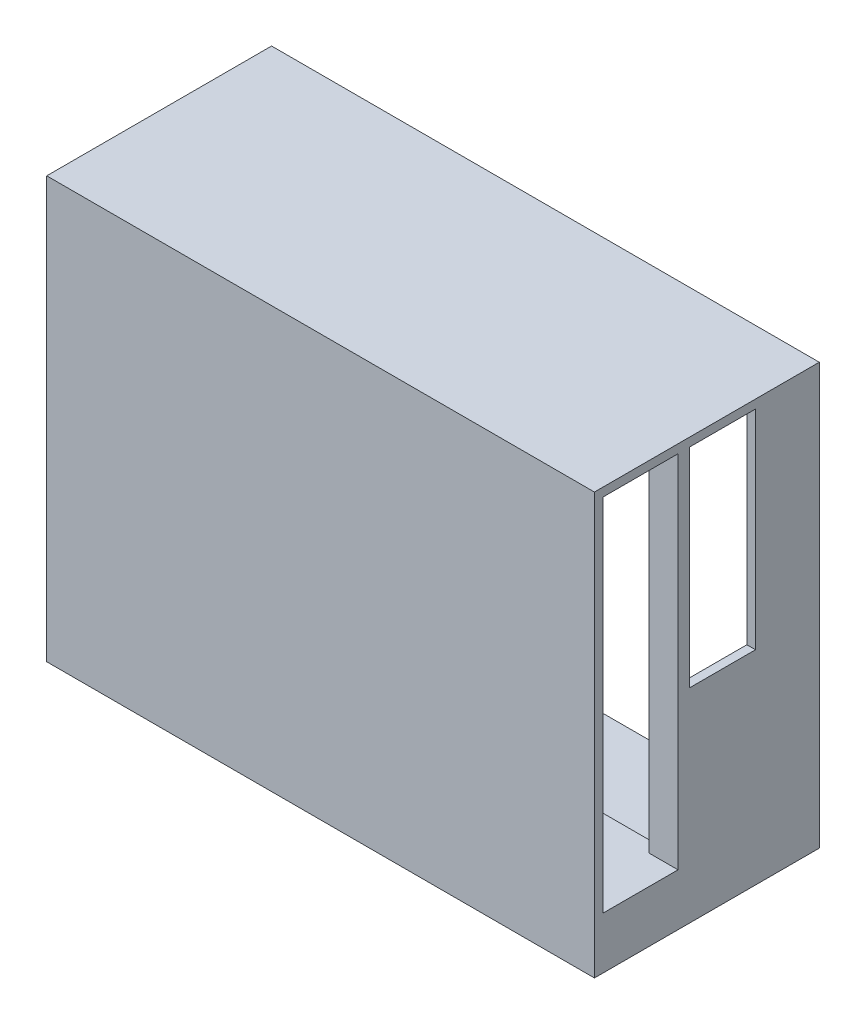
from build123d import *

# Parameters (mm, degrees)
ESQUISSE3_W             = 190
ESQUISSE3_H             = 146
BOSS_EXTRU_3_DEPTH      = 3
ESQUISSE4_W             = 190
ESQUISSE4_H             = 3
BOSS_EXTRU_4_DEPTH      = 75
ESQUISSE5_W             = 190
ESQUISSE5_H             = 3
BOSS_EXTRU_5_DEPTH      = 75
ESQUISSE6_W             = 3
ESQUISSE6_H             = 140
BOSS_EXTRU_6_DEPTH      = 75
ESQUISSE7_W             = 3
ESQUISSE7_H             = 140
BOSS_EXTRU_7_DEPTH      = 75
ESQUISSE8_W             = 26
ESQUISSE8_H             = 140
ENL_V_MAT_EXTRU_1_DEPTH = 5
ESQUISSE9_W             = 50
ESQUISSE9_H             = 13.580457403
BOSS_EXTRU_8_DEPTH      = 30
ESQUISSE10_W            = 5
ESQUISSE10_H            = 126.419542597
BOSS_EXTRU_9_DEPTH      = 30
ESQUISSE12_W            = 45
ESQUISSE12_H            = 116.062132341
BOSS_EXTRU_10_DEPTH     = 5
ESQUISSE13_W            = 137
ESQUISSE13_H            = 5
BOSS_EXTRU_11_DEPTH     = 30
ESQUISSE14_W            = 134
ESQUISSE14_H            = 10
BOSS_EXTRU_12_DEPTH     = 4
ESQUISSE15_W            = 26
ESQUISSE15_H            = 10
BOSS_EXTRU_13_DEPTH     = 5
ESQUISSE16_W            = 4
ESQUISSE16_H            = 125
BOSS_EXTRU_14_DEPTH     = 7
ESQUISSE17_W            = 22.881021534
ESQUISSE17_H            = 72.322375242
ENL_V_MAT_EXTRU_2_DEPTH = 3
ESQUISSE19_W            = 44.999866494
ESQUISSE19_H            = 10.48475091
BOSS_EXTRU_15_DEPTH     = 3


with BuildPart() as part:
    # Esquisse3 → Boss.-Extru.3 (new body)
    with BuildSketch(Plane.XY):
        Rectangle(ESQUISSE3_W, ESQUISSE3_H)
    extrude(amount=BOSS_EXTRU_3_DEPTH)

    # Esquisse4 → Boss.-Extru.4 (add)
    with BuildSketch(Plane(origin=(0, 0, 0), x_dir=(-1, 0, 0), z_dir=(0, 0, -1))):
        with Locations((0, -71.5)):
            Rectangle(ESQUISSE4_W, ESQUISSE4_H)
    extrude(amount=BOSS_EXTRU_4_DEPTH)

    # Esquisse5 → Boss.-Extru.5 (add)
    with BuildSketch(Plane(origin=(0, 0, 0), x_dir=(-1, 0, 0), z_dir=(0, 0, -1))):
        with Locations((0, 71.5)):
            Rectangle(ESQUISSE5_W, ESQUISSE5_H)
    extrude(amount=BOSS_EXTRU_5_DEPTH)

    # Esquisse6 → Boss.-Extru.6 (add)
    with BuildSketch(Plane(origin=(0, 0, 0), x_dir=(-1, 0, 0), z_dir=(0, 0, -1))):
        with Locations((93.5, 0)):
            Rectangle(ESQUISSE6_W, ESQUISSE6_H)
    extrude(amount=BOSS_EXTRU_6_DEPTH)

    # Esquisse7 → Boss.-Extru.7 (add)
    with BuildSketch(Plane(origin=(0, 0, 0), x_dir=(-1, 0, 0), z_dir=(0, 0, -1))):
        with Locations((-93.5, 0)):
            Rectangle(ESQUISSE7_W, ESQUISSE7_H)
    extrude(amount=BOSS_EXTRU_7_DEPTH)

    # Esquisse8 → Enlèv. mat.-Extru.1 (cut)
    with BuildSketch(Plane.ZY.offset(-92)):
        with Locations((-13, 0)):
            Rectangle(ESQUISSE8_W, ESQUISSE8_H)
    extrude(amount=-ENL_V_MAT_EXTRU_1_DEPTH, mode=Mode.SUBTRACT)

    # Esquisse9 → Boss.-Extru.8 (add)
    with BuildSketch(Plane(origin=(0, 0, 0), x_dir=(-1, 0, 0), z_dir=(0, 0, -1))):
        with Locations((67, 63.209771299)):
            Rectangle(ESQUISSE9_W, ESQUISSE9_H)
    extrude(amount=BOSS_EXTRU_8_DEPTH)

    # Esquisse10 → Boss.-Extru.9 (add)
    with BuildSketch(Plane(origin=(0, 0, 0), x_dir=(-1, 0, 0), z_dir=(0, 0, -1))):
        with Locations((44.5, -6.790228701)):
            Rectangle(ESQUISSE10_W, ESQUISSE10_H)
    extrude(amount=BOSS_EXTRU_9_DEPTH)

    # Esquisse12 → Boss.-Extru.10 (add)
    with BuildSketch(Plane(origin=(0, 0, -30), x_dir=(-1, 0, 0), z_dir=(0, 0, -1))):
        with Locations((69.5, -1.611523574)):
            Rectangle(ESQUISSE12_W, ESQUISSE12_H)
    extrude(amount=-BOSS_EXTRU_10_DEPTH)

    # Esquisse13 → Boss.-Extru.11 (add)
    with BuildSketch(Plane(origin=(0, 0, 0), x_dir=(-1, 0, 0), z_dir=(0, 0, -1))):
        with Locations((-26.5, -57.5)):
            Rectangle(ESQUISSE13_W, ESQUISSE13_H)
    extrude(amount=BOSS_EXTRU_11_DEPTH)

    # Esquisse14 → Boss.-Extru.12 (add)
    with BuildSketch(Plane(origin=(0, 0, -30), x_dir=(-1, 0, 0), z_dir=(0, 0, -1))):
        with Locations((-25, -65)):
            Rectangle(ESQUISSE14_W, ESQUISSE14_H)
    extrude(amount=-BOSS_EXTRU_12_DEPTH)

    # Esquisse15 → Boss.-Extru.13 (add)
    with BuildSketch(Plane(origin=(95, 0, 0), x_dir=(0, 0, -1), z_dir=(1, 0, 0))):
        with Locations((13, -65)):
            Rectangle(ESQUISSE15_W, ESQUISSE15_H)
    extrude(amount=-BOSS_EXTRU_13_DEPTH)

    # Esquisse16 → Boss.-Extru.14 (add)
    with BuildSketch(Plane.ZY.offset(-92)):
        with Locations((-28, 7.5)):
            Rectangle(ESQUISSE16_W, ESQUISSE16_H)
    extrude(amount=BOSS_EXTRU_14_DEPTH)

    # Esquisse17 → Enlèv. mat.-Extru.2 (cut)
    with BuildSketch(Plane.ZY.offset(-92)):
        with Locations((-41.440510767, 33.838812379)):
            Rectangle(ESQUISSE17_W, ESQUISSE17_H)
    extrude(amount=-ENL_V_MAT_EXTRU_2_DEPTH, mode=Mode.SUBTRACT)

    # Esquisse19 → Boss.-Extru.15 (add)
    with BuildSketch(Plane(origin=(0, 0, -30), x_dir=(-1, 0, 0), z_dir=(0, 0, -1))):
        with Locations((69.499933247, -64.884965199)):
            Rectangle(ESQUISSE19_W, ESQUISSE19_H)
    extrude(amount=-BOSS_EXTRU_15_DEPTH)


solid = part.part
